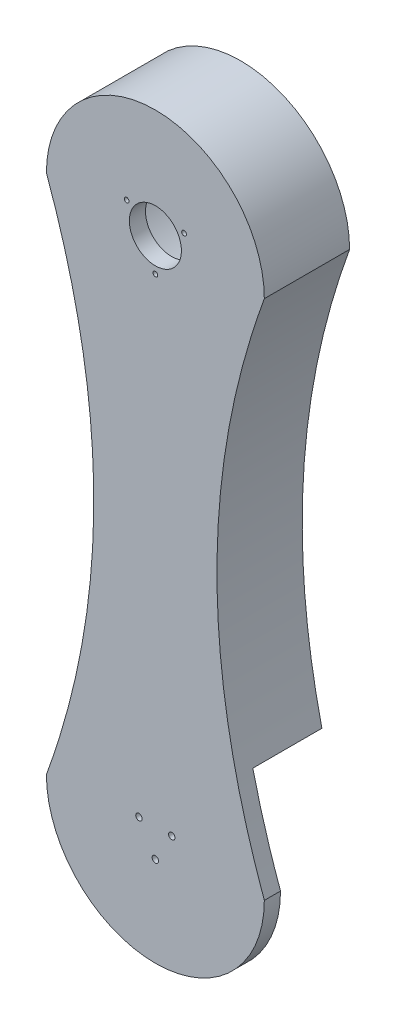
from build123d import *

# Parameters (mm, degrees)
BOSS_EXTRUDE1_DEPTH = 90
SKETCH2_R           = 97.5
CUT_EXTRUDE1_DEPTH  = 72.91
SKETCH6_R           = 97.5
CUT_EXTRUDE5_DEPTH  = 72.91
SKETCH7_R           = 27.5
CUT_EXTRUDE6_DEPTH  = 72.91
CUT_EXTRUDE10_DEPTH = 72.91
SKETCH13_R          = 3.4
CUT_EXTRUDE13_DEPTH = 17.09
SKETCH14_R          = 2.5
CUT_EXTRUDE14_DEPTH = 17.09
CIRPATTERN1_COUNT   = 3


with BuildPart() as part:
    # Sketch1 → Boss-Extrude1 (new body)
    with BuildSketch(Plane(origin=(0, 0, 0), x_dir=(0, 1, 0), z_dir=(0, 0, 1))):
        with BuildLine():
            ThreePointArc((0, 115), (-115, 0), (0, -115))
            add(Edge.make_bspline(
                [(0, -115), (275, -15), (550, -115)],
                knots=[0, 0, 0, 1, 1, 1], degree=2))
            ThreePointArc((550, -115), (665, 0), (550, 115))
            add(Edge.make_bspline(
                [(0, 115), (275, 15), (550, 115)],
                knots=[0, 0, 0, 1, 1, 1], degree=2))
        make_face()
    extrude(amount=BOSS_EXTRUDE1_DEPTH)

    # Sketch2 → Cut-Extrude1 (cut)
    with BuildSketch(Plane(origin=(0, 0, 0), x_dir=(1, 0, 0), z_dir=(0, 0, -1))):
        with Locations(Location((0, 0, 0), (0, 0, 180))):
            Circle(SKETCH2_R)
    extrude(amount=-CUT_EXTRUDE1_DEPTH, mode=Mode.SUBTRACT)

    # Sketch6 → Cut-Extrude5 (cut)
    with BuildSketch(Plane(origin=(0, 0, 0), x_dir=(1, 0, 0), z_dir=(0, 0, -1))):
        with Locations(Location((0, -550, 0), (0, 0, 180))):
            Circle(SKETCH6_R)
    extrude(amount=-CUT_EXTRUDE5_DEPTH, mode=Mode.SUBTRACT)

    # Sketch7 → Cut-Extrude6 (cut)
    with BuildSketch(Plane(origin=(0, 0, 72.91), x_dir=(1, 0, 0), z_dir=(0, 0, -1))):
        with Locations(Location((0, -550, 0), (0, 0, 180))):
            Circle(SKETCH7_R)
    extrude(amount=-CUT_EXTRUDE6_DEPTH, mode=Mode.SUBTRACT)

    # Sketch10 → Cut-Extrude10 (cut)
    with BuildSketch(Plane(origin=(0, 0, 0), x_dir=(1, 0, 0), z_dir=(0, 0, -1))):
        with BuildLine():
            ThreePointArc((115, 0), (0, 115), (-115, 0))
            add(Edge.make_bspline(
                [(-85.785633537, -97.691594321), (-97.237891942, -48.84579716), (-115, 0)],
                knots=[0, 0, 0, 1, 1, 1], degree=2))
            ThreePointArc((-85.785633537, -97.691594321), (0, -117.630315166), (85.785633537, -97.691594321))
            add(Edge.make_bspline(
                [(115, 0), (97.237891942, -48.84579716), (85.785633537, -97.691594321)],
                knots=[0, 0, 0, 1, 1, 1], degree=2))
        make_face()
    extrude(amount=-CUT_EXTRUDE10_DEPTH, mode=Mode.SUBTRACT)

    # Sketch13 → Cut-Extrude13 (cut)
    with BuildSketch(Plane(origin=(0, 0, 72.91), x_dir=(1, 0, 0), z_dir=(0, 0, -1))):
        with Locations(Location((0, 20, 0), (0, 0, 180))):
            Circle(SKETCH13_R)
        with Locations(Location((-17.320508076, -10, 0), (0, 0, 180))):
            Circle(SKETCH13_R)
        with Locations(Location((17.320508076, -10, 0), (0, 0, 180))):
            Circle(SKETCH13_R)
    extrude(amount=-CUT_EXTRUDE13_DEPTH, mode=Mode.SUBTRACT)

    # Sketch14 → Cut-Extrude14 (cut)
    with BuildSketch(Plane.XY.offset(90)):
        with Locations((0, 515)):
            Circle(SKETCH14_R)
    cut_extrude14 = extrude(amount=-CUT_EXTRUDE14_DEPTH, mode=Mode.SUBTRACT)

    # CirPattern1: Cut-Extrude14 ×3 about axis
    cirpattern1_axis = Axis((0, 550, 0), (0, 0, 1))
    for i in range(1, CIRPATTERN1_COUNT):
        add(cut_extrude14.rotate(cirpattern1_axis, i * 360 / CIRPATTERN1_COUNT), mode=Mode.SUBTRACT)


solid = part.part
